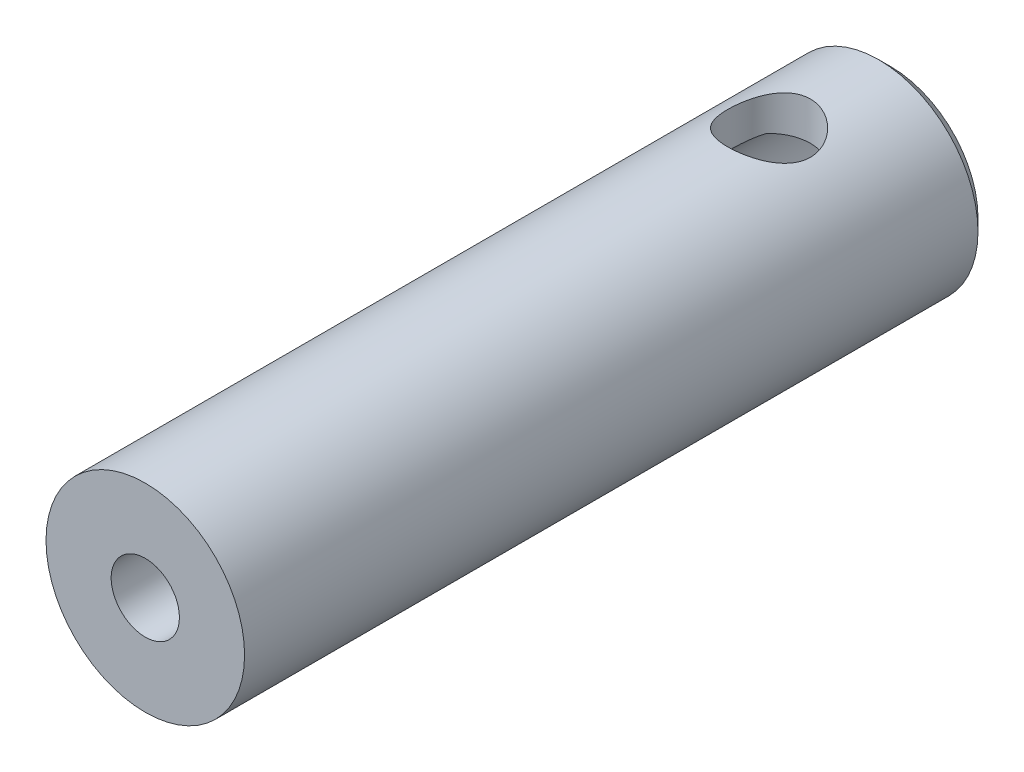
from build123d import *

# Parameters (mm, degrees)
ESQUISSE1_R             = 4.075
BOSS_EXTRU_1_DEPTH      = 30.6
ENL_V_MAT_EXTRU_1_DEPTH = 14
ESQUISSE3_R             = 2.8
ENL_V_MAT_EXTRU_2_DEPTH = 3
CHANFREIN1_SIZE         = 0.5
ESQUISSE5_R             = 1.4
ENL_V_MAT_EXTRU_4_DEPTH = 10
D_GAGEMENT_M31_D        = 3.4
D_GAGEMENT_M31_DEPTH    = 4
D_GAGEMENT_M31_TIP      = 1.021463052


with BuildPart() as part:
    # Esquisse1 → Boss.-Extru.1 (new body)
    with BuildSketch(Plane.XY):
        Circle(ESQUISSE1_R)
    extrude(amount=BOSS_EXTRU_1_DEPTH)

    # Esquisse2 → Enlèv. mat.-Extru.1 (cut)
    with BuildSketch(Plane(origin=(0, 0, 0), x_dir=(-1, 0, 0), z_dir=(0, 0, -1))):
        with BuildLine():
            Line((-1.260952021, 2.5), (1.260952021, 2.5))
            ThreePointArc((1.260952021, 2.5), (0, -2.8), (-1.260952021, 2.5))
        make_face()
    extrude(amount=-ENL_V_MAT_EXTRU_1_DEPTH, mode=Mode.SUBTRACT)

    # Esquisse3 → Enlèv. mat.-Extru.2 (cut)
    with BuildSketch(Plane(origin=(0, 0, 0), x_dir=(-1, 0, 0), z_dir=(0, 0, -1))):
        Circle(ESQUISSE3_R)
    extrude(amount=-ENL_V_MAT_EXTRU_2_DEPTH, mode=Mode.SUBTRACT)

    # Chanfrein1
    chanfrein1_edges = [part.edges().sort_by_distance(p)[0] for p in [
        (-4.075, 0, 0),
    ]]
    chamfer(chanfrein1_edges, length=CHANFREIN1_SIZE)

    # Esquisse5 → Enlèv. mat.-Extru.4 (cut)
    with BuildSketch(Plane.XY.offset(30.6)):
        Circle(ESQUISSE5_R)
    extrude(amount=-ENL_V_MAT_EXTRU_4_DEPTH, mode=Mode.SUBTRACT)

    # Dégagement M31
    with Locations(Plane(origin=(0, 4.075, 0), x_dir=(1, 0, 0), z_dir=(0, 1, 0))):
        with Locations((0, -5)):
            Hole(D_GAGEMENT_M31_D / 2, depth=D_GAGEMENT_M31_DEPTH)
            with Locations((0, 0, -(D_GAGEMENT_M31_DEPTH + D_GAGEMENT_M31_TIP / 2))):  # 118° drill point
                Cone(0, D_GAGEMENT_M31_D / 2, D_GAGEMENT_M31_TIP, mode=Mode.SUBTRACT)


solid = part.part
